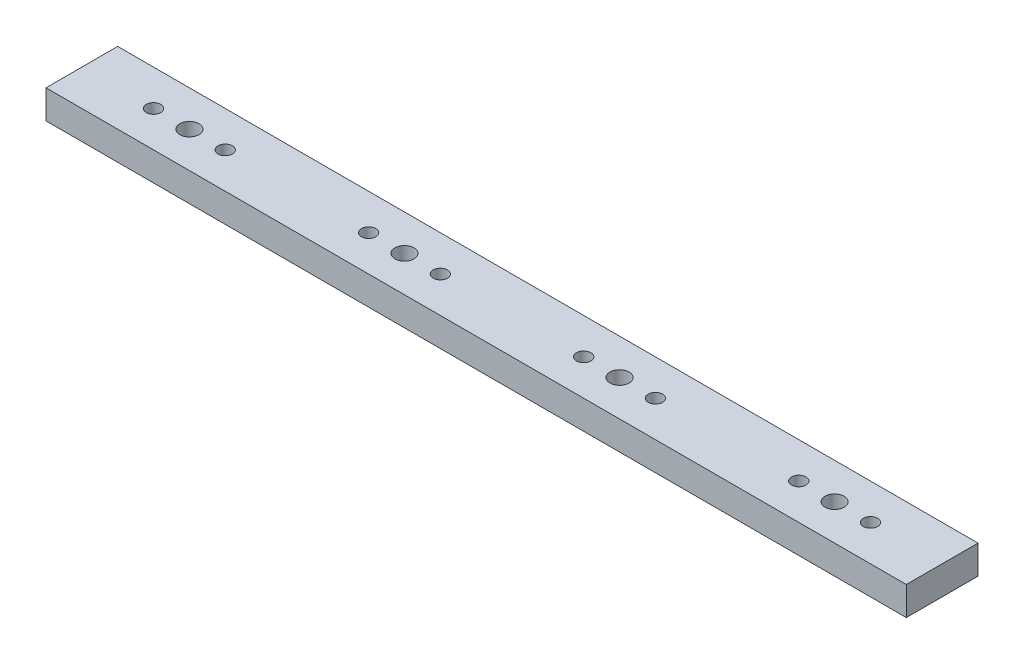
from build123d import *

# Parameters (mm, degrees)
SKETCH1_W           = 360
SKETCH1_H           = 30
BOSS_EXTRUDE1_DEPTH = 12
CUT_EXTRUDE1_REACH  = 183.022
SKETCH2_R           = 3
SKETCH2_R_2         = 4
LPATTERN1_COUNT     = 4
LPATTERN1_PITCH     = 90


with BuildPart() as part:
    # Sketch1 → Boss-Extrude1 (new body)
    with BuildSketch(Plane(origin=(0, 0, 0), x_dir=(1, 0, 0), z_dir=(0, 1, 0))):
        Rectangle(SKETCH1_W, SKETCH1_H)
    extrude(amount=BOSS_EXTRUDE1_DEPTH)

    # Sketch2 → Cut-Extrude1 (cut, up to next)
    with BuildSketch(Plane(origin=(0, 12, 0), x_dir=(1, 0, 0), z_dir=(0, 1, 0)), mode=Mode.PRIVATE) as cut_extrude1_sk1:
        with Locations(Location((-150, 0, 0), (0, 0, 270))):
            Circle(SKETCH2_R)
    cut_extrude1_tool1 = extrude(cut_extrude1_sk1.sketch, amount=-CUT_EXTRUDE1_REACH, mode=Mode.PRIVATE) & part.part
    # Sketch2 → Cut-Extrude1 (cut, up to next)
    with BuildSketch(Plane(origin=(0, 12, 0), x_dir=(1, 0, 0), z_dir=(0, 1, 0)), mode=Mode.PRIVATE) as cut_extrude1_sk2:
        with Locations(Location((-120, 0, 0), (0, 0, 270))):
            Circle(SKETCH2_R)
    cut_extrude1_tool2 = extrude(cut_extrude1_sk2.sketch, amount=-CUT_EXTRUDE1_REACH, mode=Mode.PRIVATE) & part.part
    # Sketch2 → Cut-Extrude1 (cut, up to next)
    with BuildSketch(Plane(origin=(0, 12, 0), x_dir=(1, 0, 0), z_dir=(0, 1, 0)), mode=Mode.PRIVATE) as cut_extrude1_sk3:
        with Locations(Location((-135, 0, 0), (0, 0, 270))):
            Circle(SKETCH2_R_2)
    cut_extrude1_tool3 = extrude(cut_extrude1_sk3.sketch, amount=-CUT_EXTRUDE1_REACH, mode=Mode.PRIVATE) & part.part
    cut_extrude1_1 = cut_extrude1_tool1.solids().sort_by_distance((-150, 12, 0))[0]
    add(cut_extrude1_1, mode=Mode.SUBTRACT)
    cut_extrude1_2 = cut_extrude1_tool2.solids().sort_by_distance((-120, 12, 0))[0]
    add(cut_extrude1_2, mode=Mode.SUBTRACT)
    cut_extrude1_3 = cut_extrude1_tool3.solids().sort_by_distance((-135, 12, 0))[0]
    add(cut_extrude1_3, mode=Mode.SUBTRACT)
    cut_extrude1 = cut_extrude1_1 + cut_extrude1_2 + cut_extrude1_3  # Cut-Extrude1 as one shape, for the pattern or mirror that repeats it

    # LPattern1: Cut-Extrude1 ×4
    with Locations(*[(i * LPATTERN1_PITCH, 0, 0) for i in range(1, LPATTERN1_COUNT)]):
        add(cut_extrude1, mode=Mode.SUBTRACT)


solid = part.part
